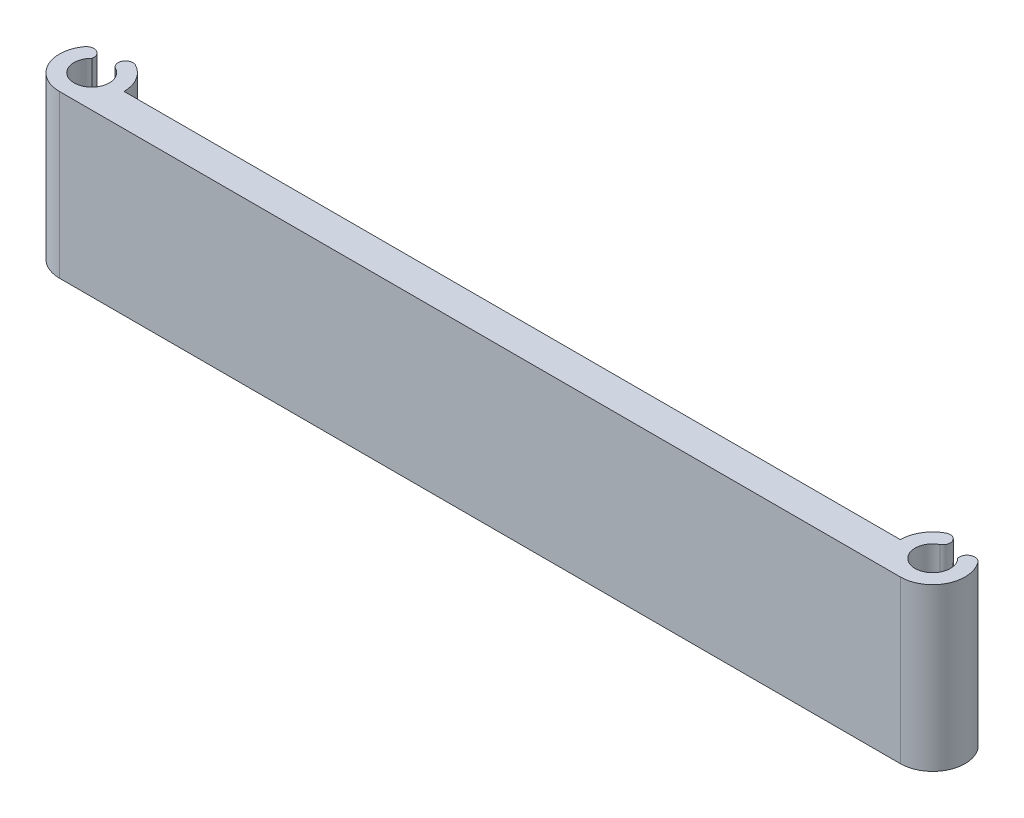
from build123d import *

# Parameters (mm, degrees)
RESSALTO_EXTRUS_O1_DEPTH = 30


with BuildPart() as part:
    # Esboço1 → Ressalto-extrusão1 (new body)
    with BuildSketch(Plane(origin=(0, 0, 0), x_dir=(1, 0, 0), z_dir=(0, 1, 0))):
        with BuildLine():
            Line((-72, 0), (72, 0))
            ThreePointArc((72, 0), (72.85009345, 3.078711179), (75.159487509, 5.285024956))
            ThreePointArc((75.159487509, 5.285024956), (77.004661638, 4.729916917), (76.449553599, 2.884742789))
            ThreePointArc((76.449553599, 2.884742789), (77.536782743, -3.242075689), (80.296246294, 2.335139815))
            ThreePointArc((80.296246294, 2.335139815), (81.096189798, 3.978813584), (82.863892701, 3.513196237))
            ThreePointArc((82.863892701, 3.513196237), (83.342245662, -2.731375348), (78, -6))
            Line((78, -6), (-78, -6))
            ThreePointArc((-78, -6), (-83.342245662, -2.731375348), (-82.863892701, 3.513196237))
            ThreePointArc((-82.863892701, 3.513196237), (-81.096189798, 3.978813584), (-80.296246294, 2.335139815))
            ThreePointArc((-80.296246294, 2.335139815), (-77.536782743, -3.242075689), (-76.449553599, 2.884742789))
            ThreePointArc((-76.449553599, 2.884742789), (-77.004661638, 4.729916917), (-75.159487509, 5.285024956))
            ThreePointArc((-75.159487509, 5.285024956), (-72.85009345, 3.078711179), (-72, 0))
        make_face()
    extrude(amount=RESSALTO_EXTRUS_O1_DEPTH)


solid = part.part
